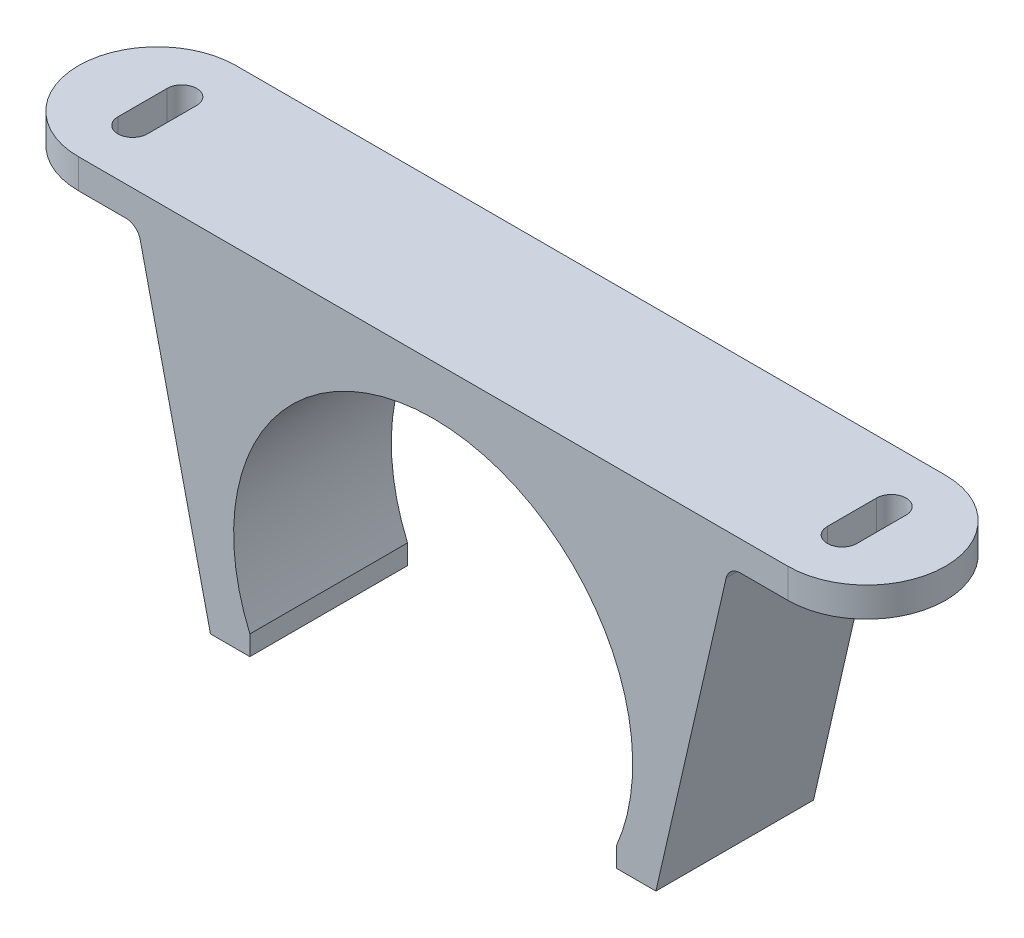
from build123d import *

# Parameters (mm, degrees)
SALIENTE_EXTRUIR1_DEPTH = 16
SALIENTE_EXTRUIR2_DEPTH = 3
REDONDEO1_R             = 1.5


with BuildPart() as part:
    # Croquis1 → Saliente-Extruir1 (new body)
    with BuildSketch(Plane.XY):
        with BuildLine():
            Line((18.602755172, -8), (18.602755172, -10))
            Line((18.602755172, -10), (22.602755172, -10))
            Line((22.602755172, -10), (30, 22.25))
            Line((30, 22.25), (-30, 22.25))
            Line((-30, 22.25), (-22.602755172, -10))
            Line((-22.602755172, -10), (-18.602755172, -10))
            Line((-18.602755172, -10), (-18.602755172, -8))
            ThreePointArc((-18.602755172, -8), (0, 20.25), (18.602755172, -8))
        make_face()
    extrude(amount=SALIENTE_EXTRUIR1_DEPTH)

    # Croquis2 → Saliente-Extruir2 (add)
    with BuildSketch(Plane(origin=(0, 22.25, 0), x_dir=(1, 0, 0), z_dir=(0, 1, 0))):
        with BuildLine():
            Line((30, 0), (-30, 0))
            Line((-30, 0), (-36, 0))
            ThreePointArc((-36, 0), (-44, -8), (-36, -16))
            Line((-36, -16), (-30, -16))
            Line((-30, -16), (30, -16))
            Line((30, -16), (36, -16))
            ThreePointArc((36, -16), (44, -8), (36, 0))
            Line((36, 0), (30, 0))
        make_face()
        with BuildLine():
            Line((-37.5, -10.5), (-37.5, -5.5))
            ThreePointArc((-37.5, -5.5), (-36, -4), (-34.5, -5.5))
            Line((-34.5, -5.5), (-34.5, -10.5))
            ThreePointArc((-34.5, -10.5), (-36, -12), (-37.5, -10.5))
        make_face(mode=Mode.SUBTRACT)
        with BuildLine():
            Line((34.5, -10.5), (34.5, -5.5))
            ThreePointArc((34.5, -5.5), (36, -4), (37.5, -5.5))
            Line((37.5, -5.5), (37.5, -10.5))
            ThreePointArc((37.5, -10.5), (36, -12), (34.5, -10.5))
        make_face(mode=Mode.SUBTRACT)
    extrude(amount=SALIENTE_EXTRUIR2_DEPTH)

    # Redondeo1
    redondeo1_edges = [part.edges().sort_by_distance(p)[0] for p in [
        (-30, 22.25, 8),
        (30, 22.25, 8),
    ]]
    fillet(redondeo1_edges, radius=REDONDEO1_R)


solid = part.part
